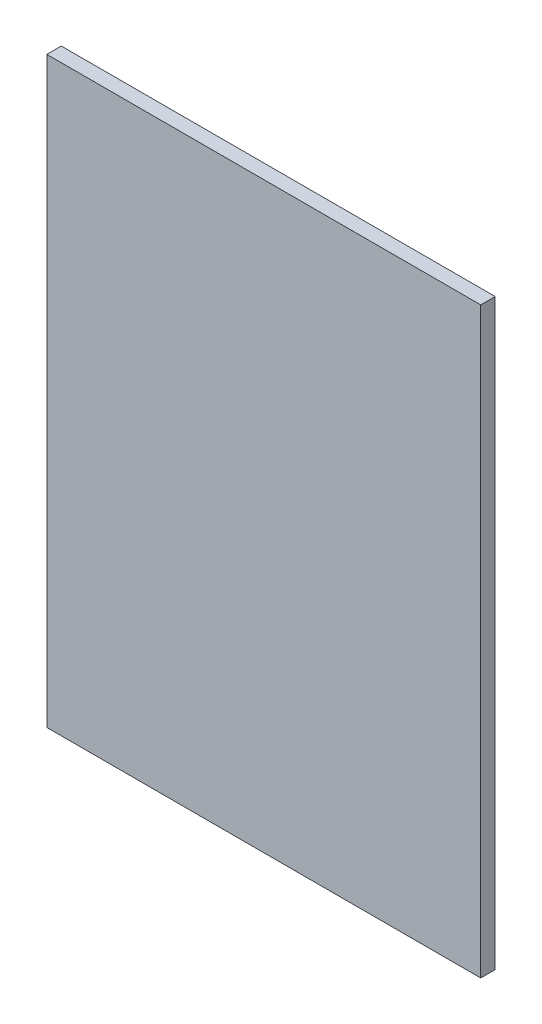
from build123d import *

# Parameters (mm, degrees)
SKETCH1_W           = 76.2
SKETCH1_H           = 102.362
BOSS_EXTRUDE1_DEPTH = 2.54


with BuildPart() as part:
    # Sketch1 → Boss-Extrude1 (new body)
    with BuildSketch(Plane.XY):
        Rectangle(SKETCH1_W, SKETCH1_H)
    extrude(amount=BOSS_EXTRUDE1_DEPTH)


solid = part.part
